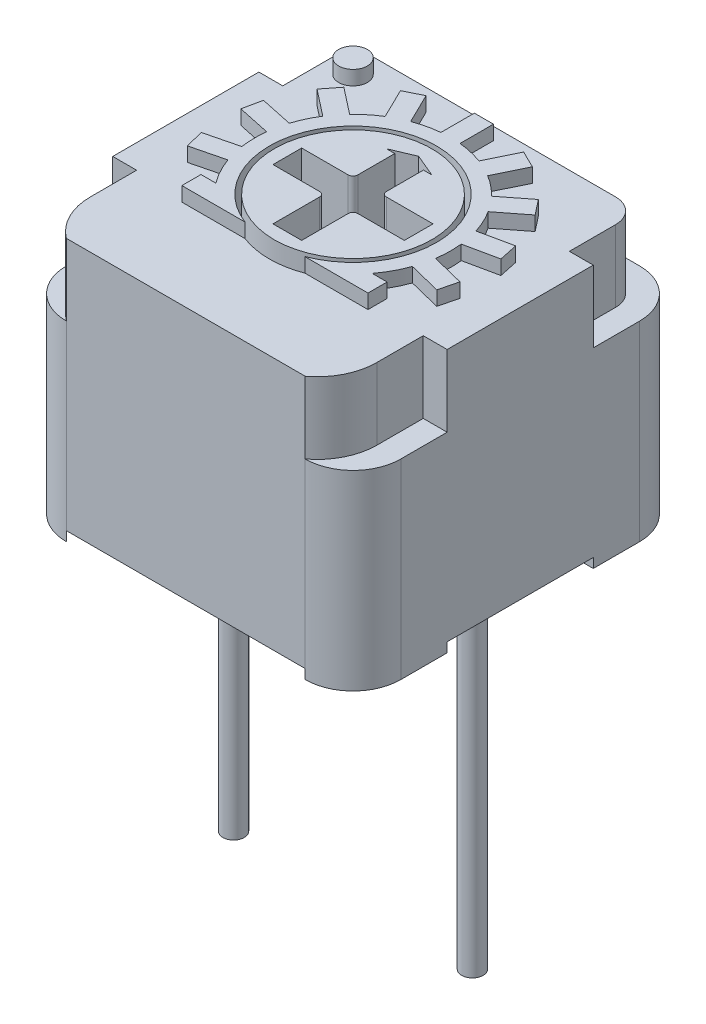
from build123d import *

# Parameters (mm, degrees)
BOSS_EXTRUDE1_DEPTH   = 5.5
SKETCH3_R             = 1.75
CUT_EXTRUDE1_DEPTH    = 1.75
SKETCH4_R             = 1.65
BOSS_EXTRUDE2_DEPTH   = 2.05
CUT_EXTRUDE2_DEPTH    = 1.6
FILLET1_R             = 0.1
BOSS_EXTRUDE3_START   = 0.3
BOSS_EXTRUDE3_DEPTH   = 0.3
SKETCH7_R             = 0.3
BOSS_EXTRUDE4_DEPTH   = 0.3
CUT_EXTRUDE3_START    = -1.5
CUT_EXTRUDE3_DEPTH    = 1.5
FILLET2_R             = 0.5
CUT_EXTRUDE7_DEPTH    = 0.2
SKETCH11_R            = 0.225
BOSS_EXTRUDE6_DEPTH   = 7.2
BOSS_EXTRUDE6_2_DEPTH = 7.2
BOSS_EXTRUDE6_3_DEPTH = 7.2


with BuildPart() as part:
    # Sketch1 → Boss-Extrude1 (new body)
    with BuildSketch(Plane(origin=(0, 0, 0), x_dir=(1, 0, 0), z_dir=(0, 1, 0))):
        with BuildLine():
            Line((2.5, -3.5), (-2.5, -3.5))
            ThreePointArc((-2.5, -3.5), (-3.207106781, -3.207106781), (-3.5, -2.5))
            Line((-3.5, -2.5), (-3.5, 2.5))
            ThreePointArc((-3.5, 2.5), (-3.207106781, 3.207106781), (-2.5, 3.5))
            Line((-2.5, 3.5), (2.5, 3.5))
            ThreePointArc((2.5, 3.5), (3.207106781, 3.207106781), (3.5, 2.5))
            Line((3.5, 2.5), (3.5, -2.5))
            ThreePointArc((3.5, -2.5), (3.207106781, -3.207106781), (2.5, -3.5))
        make_face()
    extrude(amount=BOSS_EXTRUDE1_DEPTH)

    # Sketch3 → Cut-Extrude1 (cut)
    with BuildSketch(Plane(origin=(0, 5.5, 0), x_dir=(1, 0, 0), z_dir=(0, 1, 0))):
        with Locations(Location((0, 0, 0), (0, 0, 270))):
            Circle(SKETCH3_R)
    extrude(amount=-CUT_EXTRUDE1_DEPTH, mode=Mode.SUBTRACT)

    # Sketch6 → Boss-Extrude3 (add)
    with BuildSketch(Plane(origin=(0, 5.5, 0), x_dir=(1, 0, 0), z_dir=(0, 1, 0)).offset(BOSS_EXTRUDE3_START)):
        with BuildLine():
            Line((-0.625, -1.634587104), (-1.948025053, -1.634587104))
            Line((-1.948025053, -1.634587104), (-1.948025053, -1.234587104))
            Line((-1.948025053, -1.234587104), (-1.636549627, -1.234587104))
            ThreePointArc((-1.636549627, -1.234587104), (-1.804732041, -0.972338553), (-1.931232927, -0.687633175))
            Line((-1.931232927, -0.687633175), (-2.610439935, -0.856978501))
            Line((-2.610439935, -0.856978501), (-2.707208693, -0.468860211))
            Line((-2.707208693, -0.468860211), (-2.028001685, -0.299514884))
            ThreePointArc((-2.028001685, -0.299514884), (-2.049687775, -0.035777433), (-2.0372192, 0.22855619))
            Line((-2.0372192, 0.22855619), (-2.72192252, 0.374094373))
            Line((-2.72192252, 0.374094373), (-2.638757844, 0.765353413))
            Line((-2.638757844, 0.765353413), (-1.954054524, 0.61981523))
            ThreePointArc((-1.954054524, 0.61981523), (-1.857930963, 0.866367437), (-1.730848049, 1.098483059))
            Line((-1.730848049, 1.098483059), (-2.282455576, 1.529446092))
            Line((-2.282455576, 1.529446092), (-2.036190986, 1.844650393))
            Line((-2.036190986, 1.844650393), (-1.484583459, 1.413687361))
            ThreePointArc((-1.484583459, 1.413687361), (-1.290106802, 1.593149221), (-1.074132643, 1.746063878))
            Line((-1.074132643, 1.746063878), (-1.380992446, 2.37521971))
            Line((-1.380992446, 2.37521971), (-1.021474827, 2.550568169))
            Line((-1.021474827, 2.550568169), (-0.714615024, 1.921412336))
            ThreePointArc((-0.714615024, 1.921412336), (-0.461149661, 1.997458633), (-0.2, 2.040220576))
            Line((-0.2, 2.040220576), (-0.2, 2.740220576))
            Line((-0.2, 2.740220576), (0.2, 2.740220576))
            Line((0.2, 2.740220576), (0.2, 2.040220576))
            ThreePointArc((0.2, 2.040220576), (0.461149661, 1.997458633), (0.714615024, 1.921412336))
            Line((0.714615024, 1.921412336), (1.021474827, 2.550568169))
            Line((1.021474827, 2.550568169), (1.380992446, 2.37521971))
            Line((1.380992446, 2.37521971), (1.074132643, 1.746063878))
            ThreePointArc((1.074132643, 1.746063878), (1.290106802, 1.593149221), (1.484583459, 1.413687361))
            Line((1.484583459, 1.413687361), (2.036190986, 1.844650393))
            Line((2.036190986, 1.844650393), (2.282455576, 1.529446092))
            Line((2.282455576, 1.529446092), (1.730848049, 1.098483059))
            ThreePointArc((1.730848049, 1.098483059), (1.857930963, 0.866367437), (1.954054524, 0.61981523))
            Line((1.954054524, 0.61981523), (2.638757844, 0.765353413))
            Line((2.638757844, 0.765353413), (2.72192252, 0.374094373))
            Line((2.72192252, 0.374094373), (2.0372192, 0.22855619))
            ThreePointArc((2.0372192, 0.22855619), (2.049687775, -0.035777433), (2.028001685, -0.299514884))
            Line((2.028001685, -0.299514884), (2.707208693, -0.468860211))
            Line((2.707208693, -0.468860211), (2.610439935, -0.856978501))
            Line((2.610439935, -0.856978501), (1.931232927, -0.687633175))
            ThreePointArc((1.931232927, -0.687633175), (1.804732041, -0.972338553), (1.636549627, -1.234587104))
            Line((1.636549627, -1.234587104), (1.948025053, -1.234587104))
            Line((1.948025053, -1.234587104), (1.948025053, -1.634587104))
            Line((1.948025053, -1.634587104), (0.625, -1.634587104))
            ThreePointArc((0.625, -1.634587104), (0, 1.75), (-0.625, -1.634587104))
        make_face()
    extrude(amount=-BOSS_EXTRUDE3_DEPTH)

    # Sketch7 → Boss-Extrude4 (add)
    with BuildSketch(Plane(origin=(0, 5.5, 0), x_dir=(1, 0, 0), z_dir=(0, 1, 0))):
        with Locations(Location((-2.474873734, 2.474873734, 0), (0, 0, 270))):
            Circle(SKETCH7_R)
    extrude(amount=BOSS_EXTRUDE4_DEPTH)

    # Sketch2 → Cut-Extrude3 (cut)
    with BuildSketch(Plane(origin=(0, 5.5, 0), x_dir=(1, 0, 0), z_dir=(0, 1, 0)).offset(CUT_EXTRUDE3_START)):
        with BuildLine():
            ThreePointArc((-3.5, -2.5), (-3.207106781, -3.207106781), (-2.5, -3.5))
            ThreePointArc((-2.5, -3.5), (-2.868033989, -3.059016994), (-3, -2.5))
            Line((-3, -2.5), (-3, -1.529446092))
            Line((-3, -1.529446092), (-3.5, -1.529446092))
            Line((-3.5, -1.529446092), (-3.5, -2.5))
        make_face()
        with BuildLine():
            ThreePointArc((2.5, -3.5), (3.207106781, -3.207106781), (3.5, -2.5))
            Line((3.5, -2.5), (3.5, -1.529446092))
            Line((3.5, -1.529446092), (3, -1.529446092))
            Line((3, -1.529446092), (3, -2.5))
            ThreePointArc((3, -2.5), (2.868033989, -3.059016994), (2.5, -3.5))
        make_face()
        with BuildLine():
            Line((3, 1.529446092), (3.5, 1.529446092))
            Line((3.5, 1.529446092), (3.5, 2.5))
            ThreePointArc((3.5, 2.5), (3.207106781, 3.207106781), (2.5, 3.5))
            Line((2.5, 3.5), (-2.5, 3.5))
            ThreePointArc((-2.5, 3.5), (-3.207106781, 3.207106781), (-3.5, 2.5))
            Line((-3.5, 2.5), (-3.5, 1.529446092))
            Line((-3.5, 1.529446092), (-3, 1.529446092))
            Line((-3, 1.529446092), (-3, 3))
            Line((-3, 3), (3, 3))
            Line((3, 3), (3, 1.529446092))
        make_face()
    extrude(amount=CUT_EXTRUDE3_DEPTH, mode=Mode.SUBTRACT)

    # Fillet2
    fillet2_edges = [part.edges().sort_by_distance(p)[0] for p in [
        (3, 4.75, -3),
        (-3, 4.75, -3),
    ]]
    fillet(fillet2_edges, radius=FILLET2_R)

    # Sketch10 → Cut-Extrude7 (cut)
    with BuildSketch(Plane(origin=(0, 0, 0), x_dir=(1, 0, 0), z_dir=(0, 1, 0))):
        with BuildLine():
            Line((3, 2.5), (3, 1.529446092))
            Line((3, 1.529446092), (3.5, 1.529446092))
            Line((3.5, 1.529446092), (3.5, -1.529446092))
            Line((3.5, -1.529446092), (3, -1.529446092))
            Line((3, -1.529446092), (3, -2.5))
            ThreePointArc((3, -2.5), (2.868033989, -3.059016994), (2.5, -3.5))
            Line((2.5, -3.5), (-2.5, -3.5))
            ThreePointArc((-2.5, -3.5), (-2.868033989, -3.059016994), (-3, -2.5))
            Line((-3, -2.5), (-3, -1.529446092))
            Line((-3, -1.529446092), (-3.5, -1.529446092))
            Line((-3.5, -1.529446092), (-3.5, 1.529446092))
            Line((-3.5, 1.529446092), (-3, 1.529446092))
            Line((-3, 1.529446092), (-3, 2.5))
            ThreePointArc((-3, 2.5), (-2.853553391, 2.853553391), (-2.5, 3))
            Line((-2.5, 3), (2.5, 3))
            ThreePointArc((2.5, 3), (2.853553391, 2.853553391), (3, 2.5))
        make_face()
    extrude(amount=CUT_EXTRUDE7_DEPTH, mode=Mode.SUBTRACT)


with BuildPart() as body_2:
    # Sketch4 → Boss-Extrude2 (new body)
    with BuildSketch(Plane(origin=(0, 3.75, 0), x_dir=(1, 0, 0), z_dir=(0, 1, 0))):
        with Locations(Location((0, 0, 0), (0, 0, 270))):
            Circle(SKETCH4_R)
    extrude(amount=BOSS_EXTRUDE2_DEPTH)

    # Sketch5 → Cut-Extrude2 (cut)
    with BuildSketch(Plane(origin=(0, 5.8, 0), x_dir=(1, 0, 0), z_dir=(0, 1, 0))):
        Polygon((-0.3, 0.3), (-0.3, 1.175), (-0.475, 1.175), (0, 1.375), (0.475, 1.175), (0.3, 1.175), (0.3, 0.3), (1.375, 0.3), (1.375, -0.3), (0.3, -0.3), (0.3, -1.375), (-0.3, -1.375), (-0.3, -0.3), (-1.375, -0.3), (-1.375, 0.3), align=None)
    extrude(amount=-CUT_EXTRUDE2_DEPTH, mode=Mode.SUBTRACT)

    # Fillet1
    fillet1_edges = [body_2.edges().sort_by_distance(p)[0] for p in [
        (-0.3, 5, -0.3),
        (0.3, 5, -0.3),
        (0.3, 5, 0.3),
        (-0.3, 5, 0.3),
    ]]
    fillet(fillet1_edges, radius=FILLET1_R)


with BuildPart() as body_3:
    # Sketch11 → Boss-Extrude6 (new body)
    with BuildSketch(Plane.XZ.offset(-0.2)):
        with Locations(Location((2.5, 0, 0), (0, 0, 270))):
            Circle(SKETCH11_R)
    extrude(amount=BOSS_EXTRUDE6_DEPTH)


with BuildPart() as body_4:
    # Sketch11 → Boss-Extrude6 2 (new body)
    with BuildSketch(Plane.XZ.offset(-0.2)):
        with Locations(Location((0, -2.5, 0), (0, 0, 270))):
            Circle(SKETCH11_R)
    extrude(amount=BOSS_EXTRUDE6_2_DEPTH)


with BuildPart() as body_5:
    # Sketch11 → Boss-Extrude6 3 (new body)
    with BuildSketch(Plane.XZ.offset(-0.2)):
        with Locations(Location((-2.5, 0, 0), (0, 0, 270))):
            Circle(SKETCH11_R)
    extrude(amount=BOSS_EXTRUDE6_3_DEPTH)


solid = Compound([part.part, body_2.part, body_3.part, body_4.part, body_5.part])
